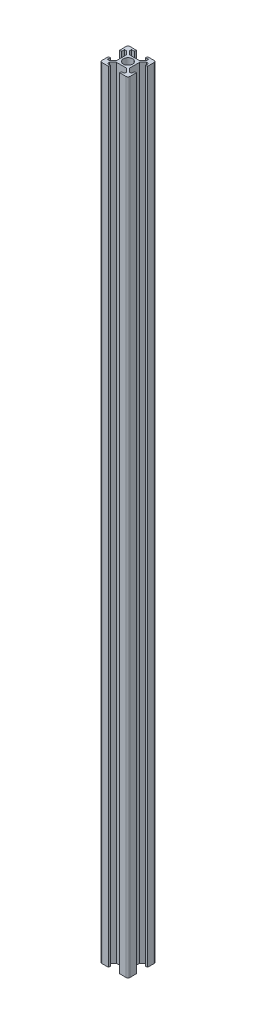
from build123d import *

# Parameters (mm, degrees)
BOSS_EXTRUDE1_DEPTH = 420


with BuildPart() as part:
    # Sketch1 → Boss-Extrude1 (new body)
    with BuildSketch(Plane(origin=(0, 0, 0), x_dir=(1, 0, 0), z_dir=(0, 1, 0))):
        with BuildLine():
            Line((-7.5, -3), (-7.5, -6.5))
            ThreePointArc((-7.5, -6.5), (-7.207106781, -7.207106781), (-6.5, -7.5))
            Line((-6.5, -7.5), (-3, -7.5))
            Line((-3, -7.5), (-3, -6.5))
            Line((-3, -6.5), (-4.6, -6.5))
            Line((-4.6, -6.5), (-4.6, -5.307106781))
            Line((-4.6, -5.307106781), (-2.8, -3.507106781))
            Line((-2.8, -3.507106781), (0, -3.507106781))
            Line((0, -3.507106781), (2.8, -3.507106781))
            Line((2.8, -3.507106781), (4.6, -5.307106781))
            Line((4.6, -5.307106781), (4.6, -6.5))
            Line((4.6, -6.5), (3, -6.5))
            Line((3, -6.5), (3, -7.5))
            Line((3, -7.5), (6.5, -7.5))
            ThreePointArc((6.5, -7.5), (7.207106781, -7.207106781), (7.5, -6.5))
            Line((7.5, -6.5), (7.5, -3))
            Line((7.5, -3), (6.5, -3))
            Line((6.5, -3), (6.5, -4.6))
            Line((6.5, -4.6), (5.307106781, -4.6))
            Line((5.307106781, -4.6), (3.507106781, -2.8))
            Line((3.507106781, -2.8), (3.507106781, 0))
            Line((3.507106781, 0), (3.507106781, 2.8))
            Line((3.507106781, 2.8), (5.307106781, 4.6))
            Line((5.307106781, 4.6), (6.5, 4.6))
            Line((6.5, 4.6), (6.5, 3))
            Line((6.5, 3), (7.5, 3))
            Line((7.5, 3), (7.5, 6.5))
            ThreePointArc((7.5, 6.5), (7.207106781, 7.207106781), (6.5, 7.5))
            Line((6.5, 7.5), (3, 7.5))
            Line((3, 7.5), (3, 6.5))
            Line((3, 6.5), (4.6, 6.5))
            Line((4.6, 6.5), (4.6, 5.307106781))
            Line((4.6, 5.307106781), (2.8, 3.507106781))
            Line((2.8, 3.507106781), (0, 3.507106781))
            Line((0, 3.507106781), (-2.8, 3.507106781))
            Line((-2.8, 3.507106781), (-4.6, 5.307106781))
            Line((-4.6, 5.307106781), (-4.6, 6.5))
            Line((-4.6, 6.5), (-3, 6.5))
            Line((-3, 6.5), (-3, 7.5))
            Line((-3, 7.5), (-6.5, 7.5))
            ThreePointArc((-6.5, 7.5), (-7.207106781, 7.207106781), (-7.5, 6.5))
            Line((-7.5, 6.5), (-7.5, 3))
            Line((-7.5, 3), (-6.5, 3))
            Line((-6.5, 3), (-6.5, 4.6))
            Line((-6.5, 4.6), (-5.307106781, 4.6))
            Line((-5.307106781, 4.6), (-3.507106781, 2.8))
            Line((-3.507106781, 2.8), (-3.507106781, 0))
            Line((-3.507106781, 0), (-3.507106781, -2.8))
            Line((-3.507106781, -2.8), (-5.307106781, -4.6))
            Line((-5.307106781, -4.6), (-6.5, -4.6))
            Line((-6.5, -4.6), (-6.5, -3))
            Line((-6.5, -3), (-7.5, -3))
        make_face()
        with BuildLine():
            ThreePointArc((-2.5, 0), (-1.767766953, -1.767766953), (0, -2.5))
            ThreePointArc((0, -2.5), (1.767766953, -1.767766953), (2.5, 0))
            ThreePointArc((2.5, 0), (1.767766953, 1.767766953), (0, 2.5))
            ThreePointArc((0, 2.5), (-1.767766953, 1.767766953), (-2.5, 0))
        make_face(mode=Mode.SUBTRACT)
    extrude(amount=BOSS_EXTRUDE1_DEPTH)


solid = part.part
